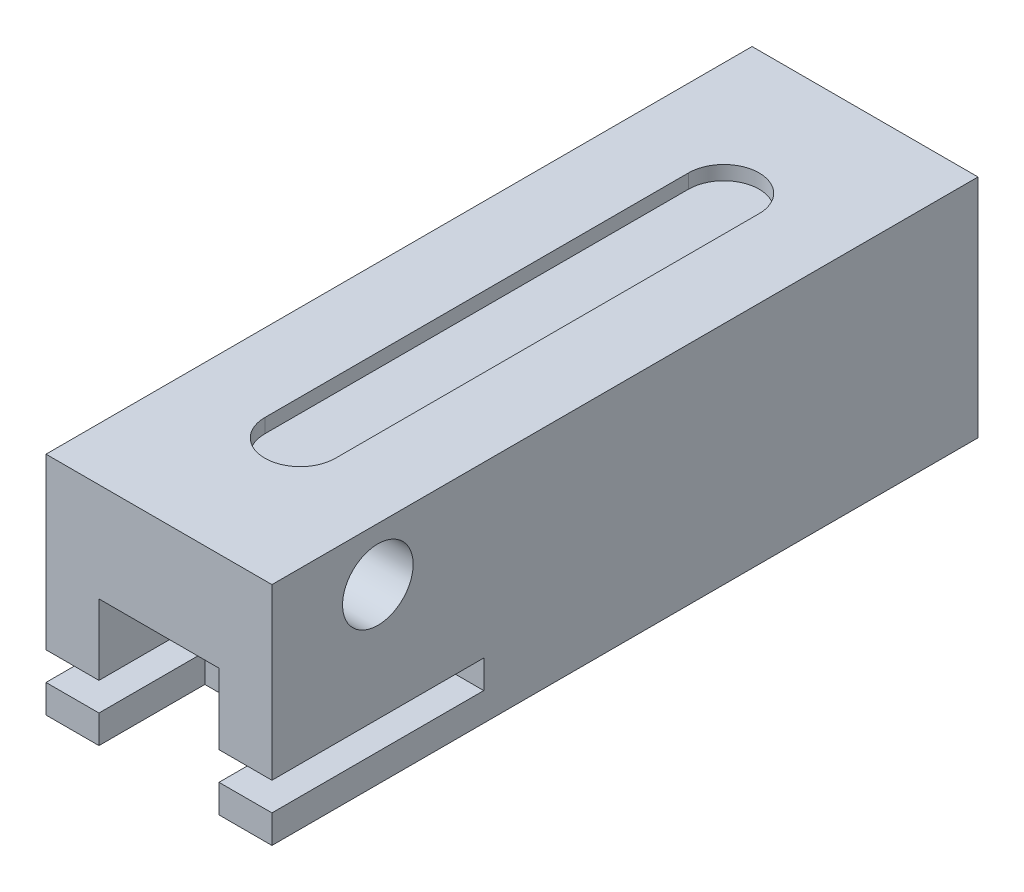
from build123d import *

# Parameters (mm, degrees)
SKETCH1_W               = 32
SKETCH1_H               = 32
BOSS_EXTRUDE1_DEPTH     = 100
CUT_EXTRUDE1_START      = 16
SKETCH2_R               = 5
CUT_EXTRUDE1_DEPTH      = 2
SKETCH3_W               = 17
SKETCH3_H               = 10
CUT_EXTRUDE2_DEPTH      = 30
SKETCH3_4_W             = 8.5
SKETCH3_4_H             = 10.001446171
CUT_EXTRUDE4_DEPTH      = 15
CUT_EXTRUDE3_DEPTH      = 103.528044944
CUT_EXTRUDE3_DEPTH_BACK = 103.528044944
SKETCH4_R               = 5


with BuildPart() as part:
    # Sketch1 → Boss-Extrude1 (new body)
    with BuildSketch(Plane.XY):
        Rectangle(SKETCH1_W, SKETCH1_H)
    extrude(amount=-BOSS_EXTRUDE1_DEPTH)

    # Sketch2 → Cut-Extrude1 (cut)
    with BuildSketch(Plane(origin=(0, 0, 0), x_dir=(1, 0, 0), z_dir=(0, 1, 0)).offset(CUT_EXTRUDE1_START)):
        with BuildLine():
            Line((5, 20), (5, 80))
            ThreePointArc((5, 80), (0, 75), (-5, 80))
            Line((-5, 80), (-5, 20))
            ThreePointArc((-5, 20), (0, 25), (5, 20))
        make_face()
        with Locations((0, 80)):
            Circle(SKETCH2_R)
        with Locations((0, 20)):
            Circle(SKETCH2_R)
    extrude(amount=-CUT_EXTRUDE1_DEPTH, mode=Mode.SUBTRACT)

    # Sketch3 → Cut-Extrude2 (cut)
    with BuildSketch(Plane.XY):
        with Locations((0, -3)):
            Rectangle(SKETCH3_W, SKETCH3_H)
        Polygon((-8.5, -8), (-16, -8), (-16, -12), (-8.5, -12), (8.5, -12), (16, -12), (16, -8), (8.5, -8), align=None)
    extrude(amount=-CUT_EXTRUDE2_DEPTH, mode=Mode.SUBTRACT)

    # Sketch3<4> → Cut-Extrude4 (cut)
    with BuildSketch(Plane.XY):
        with Locations((4.25, -17.000723085)):
            Rectangle(SKETCH3_4_W, SKETCH3_4_H)
        with Locations((-4.25, -17.000723085)):
            Rectangle(SKETCH3_4_W, SKETCH3_4_H)
    extrude(amount=-CUT_EXTRUDE4_DEPTH, mode=Mode.SUBTRACT)

    # Sketch4 → Cut-Extrude3 (cut, two sides: drawn at the far end of the back side and taken through both)
    with BuildSketch(Plane(origin=(0, 0, 0), x_dir=(0, 0, -1), z_dir=(1, 0, 0)).offset(-CUT_EXTRUDE3_DEPTH_BACK)):
        with Locations((15, 8.5)):
            Circle(SKETCH4_R)
    extrude(amount=CUT_EXTRUDE3_DEPTH + CUT_EXTRUDE3_DEPTH_BACK, mode=Mode.SUBTRACT)


solid = part.part
